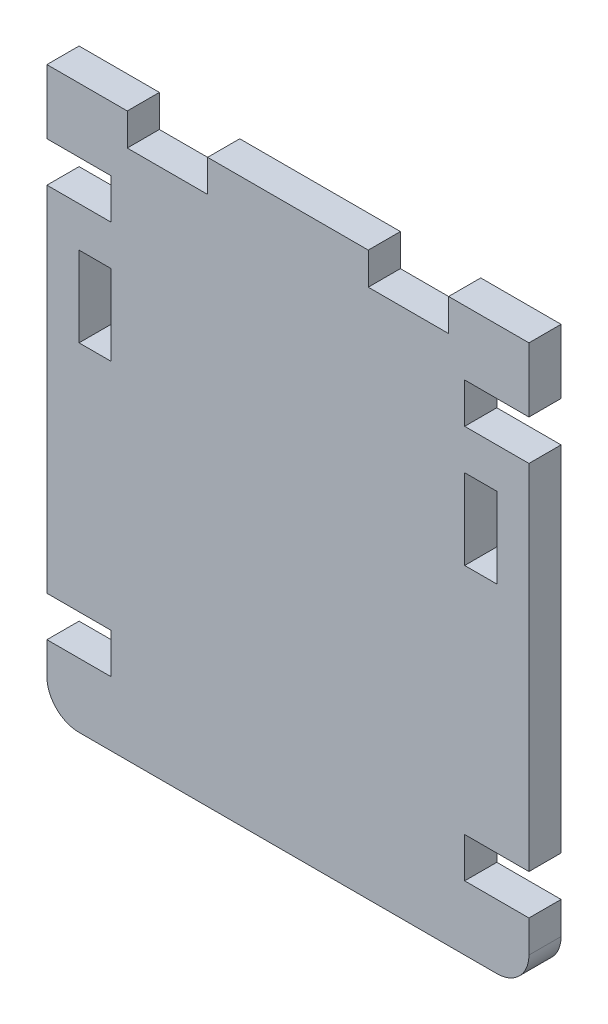
from build123d import *

# Parameters (mm, degrees)
SKETCH1_W           = 4
SKETCH1_H           = 10
BOSS_EXTRUDE2_DEPTH = 4


with BuildPart() as part:
    # Sketch1 → Boss-Extrude2 (new body)
    with BuildSketch(Plane.XY):
        with BuildLine():
            Line((-30, -27), (-22, -27))
            Line((-22, -27), (-22, -22))
            Line((-22, -22), (-30, -22))
            Line((-30, -22), (-30, 22))
            Line((-30, 22), (-22, 22))
            Line((-22, 22), (-22, 27))
            Line((-22, 27), (-30, 27))
            Line((-30, 27), (-30, 35))
            Line((-30, 35), (-20, 35))
            Line((-20, 35), (-20, 31))
            Line((-20, 31), (-10, 31))
            Line((-10, 31), (-10, 35))
            Line((-10, 35), (10, 35))
            Line((10, 35), (10, 31))
            Line((10, 31), (20, 31))
            Line((20, 31), (20, 35))
            Line((20, 35), (30, 35))
            Line((30, 35), (30, 26.999983113))
            Line((30, 26.999983113), (22, 26.999983113))
            Line((22, 26.999983113), (22, 21.999990545))
            Line((22, 21.999990545), (30, 21.999990545))
            Line((30, 21.999990545), (30, -22))
            Line((30, -22), (22, -22))
            Line((22, -22), (22, -27))
            Line((22, -27), (30, -27))
            Line((30, -27), (30, -31))
            ThreePointArc((30, -31), (28.828427125, -33.828427125), (26, -35))
            Line((26, -35), (-26, -35))
            ThreePointArc((-26, -35), (-28.828427125, -33.828427125), (-30, -31))
            Line((-30, -31), (-30, -27))
        make_face()
        with Locations((-24, 12)):
            Rectangle(SKETCH1_W, SKETCH1_H, mode=Mode.SUBTRACT)
        with Locations((24, 12)):
            Rectangle(SKETCH1_W, SKETCH1_H, mode=Mode.SUBTRACT)
    extrude(amount=BOSS_EXTRUDE2_DEPTH)


solid = part.part
